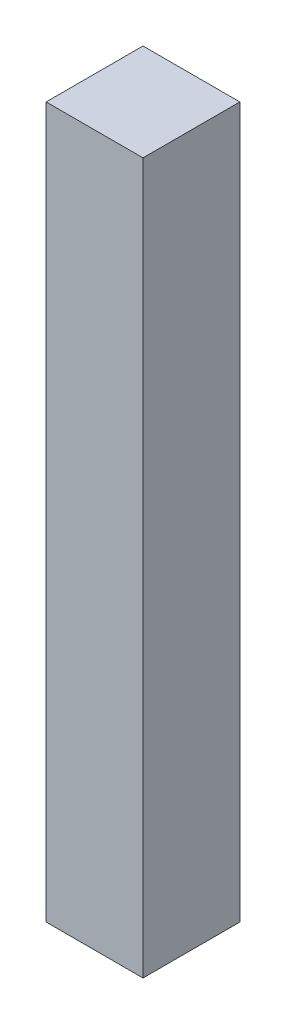
from build123d import *

# Parameters (mm, degrees)
SKETCH1_W           = 15
SKETCH1_H           = 15
BOSS_EXTRUDE1_DEPTH = 110


with BuildPart() as part:
    # Sketch1 → Boss-Extrude1 (new body)
    with BuildSketch(Plane(origin=(0, 0, 0), x_dir=(1, 0, 0), z_dir=(0, 1, 0))):
        with Locations((7.5, 7.5)):
            Rectangle(SKETCH1_W, SKETCH1_H)
    extrude(amount=BOSS_EXTRUDE1_DEPTH)


solid = part.part
